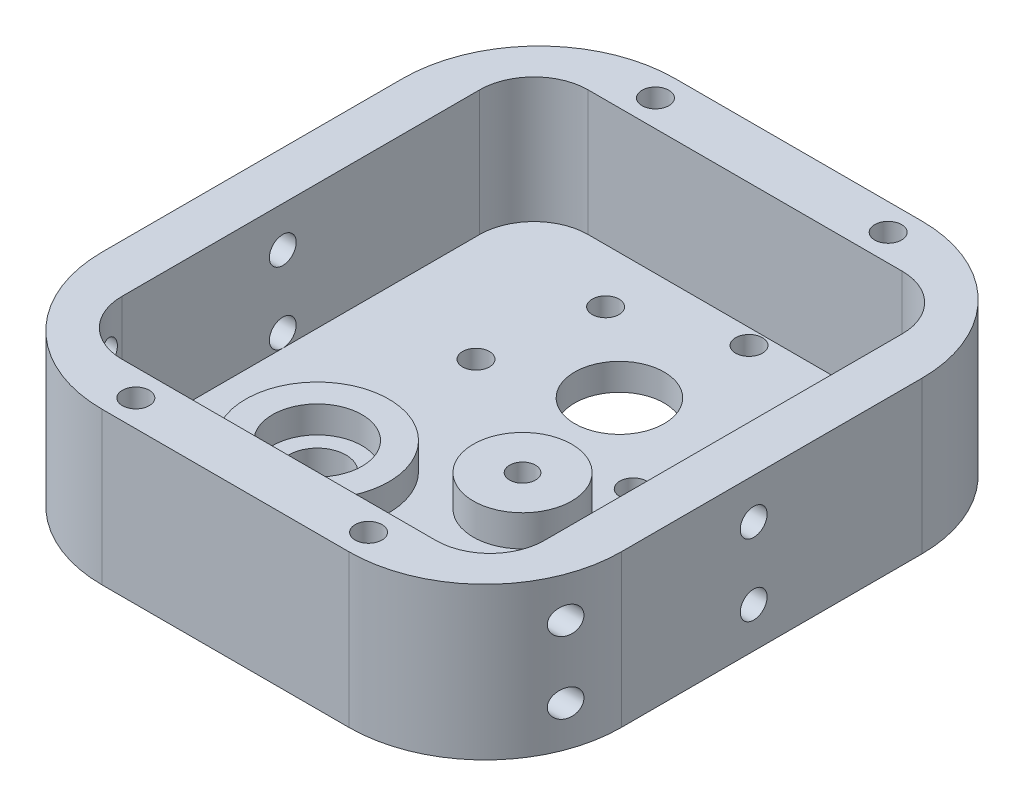
from build123d import *

# Parameters (mm, degrees)
SKETCH1_R           = 3.2
SKETCH1_R_2         = 5
SKETCH1_R_3         = 1.45
BOSS_EXTRUDE1_DEPTH = 3
SKETCH1_4_R         = 5.5
SKETCH1_4_R_2       = 1.45
BOSS_EXTRUDE2_DEPTH = 6.5
SKETCH1_5_R         = 8
SKETCH1_5_R_2       = 5
BOSS_EXTRUDE3_DEPTH = 6
BOSS_EXTRUDE4_DEPTH = 17
SKETCH4_R           = 1.5
CUT_EXTRUDE2_DEPTH  = 14
SKETCH2_R           = 1.5
CUT_EXTRUDE4_DEPTH  = 3
SKETCH5_R           = 1.5
CUT_EXTRUDE5_DEPTH  = 8


with BuildPart() as part:
    # Sketch1 → Boss-Extrude1 (new body)
    with BuildSketch(Plane(origin=(0, 0, 0), x_dir=(1, 0, 0), z_dir=(0, 1, 0))):
        with BuildLine():
            Line((-29, -28.777515286), (-29, 4.777515286))
            ThreePointArc((-29, 4.777515286), (-24.541437454, 15.541437454), (-13.777515286, 20))
            Line((-13.777515286, 20), (13.777515286, 20))
            ThreePointArc((13.777515286, 20), (24.541437454, 15.541437454), (29, 4.777515286))
            Line((29, 4.777515286), (29, -28.777515286))
            ThreePointArc((29, -28.777515286), (24.541437454, -39.541437454), (13.777515286, -44))
            Line((13.777515286, -44), (-13.777515286, -44))
            ThreePointArc((-13.777515286, -44), (-24.541437454, -39.541437454), (-29, -28.777515286))
        make_face()
        with Locations(Location((-9.753243024, -24, 0), (0, 0, 270))):
            Circle(SKETCH1_R, mode=Mode.SUBTRACT)
        with Locations(Location((0, 0, 0), (0, 0, 270))):
            Circle(SKETCH1_R_2, mode=Mode.SUBTRACT)
        with Locations(Location((5.323230148, -16.145068002, 0), (0, 0, 270))):
            Circle(SKETCH1_R_3, mode=Mode.SUBTRACT)
    extrude(amount=BOSS_EXTRUDE1_DEPTH)

    # Sketch1<4> → Boss-Extrude2 (add)
    with BuildSketch(Plane(origin=(0, 0, 0), x_dir=(1, 0, 0), z_dir=(0, 1, 0))):
        with Locations(Location((5.323230148, -16.145068002, 0), (0, 0, 90))):
            Circle(SKETCH1_4_R)
        with Locations(Location((5.323230148, -16.145068002, 0), (0, 0, 270))):
            Circle(SKETCH1_4_R_2, mode=Mode.SUBTRACT)
    extrude(amount=BOSS_EXTRUDE2_DEPTH)

    # Sketch1<5> → Boss-Extrude3 (add)
    with BuildSketch(Plane(origin=(0, 0, 0), x_dir=(1, 0, 0), z_dir=(0, 1, 0))):
        with Locations(Location((-9.753243024, -24, 0), (0, 0, 270))):
            Circle(SKETCH1_5_R)
        with Locations(Location((-9.753243024, -24, 0), (0, 0, 270))):
            Circle(SKETCH1_5_R_2, mode=Mode.SUBTRACT)
    extrude(amount=BOSS_EXTRUDE3_DEPTH)

    # Sketch3 → Boss-Extrude4 (add)
    with BuildSketch(Plane(origin=(0, 0, 0), x_dir=(1, 0, 0), z_dir=(0, 1, 0))):
        with BuildLine():
            Line((-13.777515286, -44), (13.777515286, -44))
            ThreePointArc((13.777515286, -44), (24.541437454, -39.541437454), (29, -28.777515286))
            Line((29, -28.777515286), (29, 4.777515286))
            ThreePointArc((29, 4.777515286), (24.541437454, 15.541437454), (13.777515286, 20))
            Line((13.777515286, 20), (-13.777515286, 20))
            ThreePointArc((-13.777515286, 20), (-24.541437454, 15.541437454), (-29, 4.777515286))
            Line((-29, 4.777515286), (-29, -28.777515286))
            ThreePointArc((-29, -28.777515286), (-24.541437454, -39.541437454), (-13.777515286, -44))
        make_face()
        with BuildLine():
            Line((-17.54612958, -38.049633972), (17.54612958, -38.049633972))
            ThreePointArc((17.54612958, -38.049633972), (21.832152122, -36.274305307), (23.607480787, -31.988282765))
            Line((23.607480787, -31.988282765), (23.607480787, 7.988282765))
            ThreePointArc((23.607480787, 7.988282765), (21.832152122, 12.274305307), (17.54612958, 14.049633972))
            Line((17.54612958, 14.049633972), (-17.54612958, 14.049633972))
            ThreePointArc((-17.54612958, 14.049633972), (-21.832152122, 12.274305307), (-23.607480787, 7.988282765))
            Line((-23.607480787, 7.988282765), (-23.607480787, -31.988282765))
            ThreePointArc((-23.607480787, -31.988282765), (-21.832152122, -36.274305307), (-17.54612958, -38.049633972))
        make_face(mode=Mode.SUBTRACT)
    extrude(amount=BOSS_EXTRUDE4_DEPTH)

    # Sketch4 → Cut-Extrude2 (cut)
    with BuildSketch(Plane(origin=(0, 17, 0), x_dir=(1, 0, 0), z_dir=(0, 1, 0))):
        with Locations(Location((13, 17.024816986, 0), (0, 0, 270))):
            Circle(SKETCH4_R)
        with Locations(Location((-13, 17.024816986, 0), (0, 0, 270))):
            Circle(SKETCH4_R)
        with Locations(Location((-13, -41.024816986, 0), (0, 0, 270))):
            Circle(SKETCH4_R)
        with Locations(Location((13, -41.024816986, 0), (0, 0, 270))):
            Circle(SKETCH4_R)
    extrude(amount=-CUT_EXTRUDE2_DEPTH, mode=Mode.SUBTRACT)

    # Sketch2 → Cut-Extrude4 (cut)
    with BuildSketch(Plane(origin=(0, 0, 0), x_dir=(1, 0, 0), z_dir=(0, 1, 0))):
        with Locations(Location((2.170602221, 12.310096913, 0), (0, 0, 270))):
            Circle(SKETCH2_R)
        with Locations(Location((-9.575555539, 8.034845121, 0), (0, 0, 270))):
            Circle(SKETCH2_R)
        with Locations(Location((-11.74615776, -4.275251792, 0), (0, 0, 270))):
            Circle(SKETCH2_R)
        with Locations(Location((-2.170602221, -12.310096913, 0), (0, 0, 270))):
            Circle(SKETCH2_R)
        with Locations(Location((11.74615776, 4.275251792, 0), (0, 0, 270))):
            Circle(SKETCH2_R)
        with Locations(Location((9.575555539, -8.034845121, 0), (0, 0, 270))):
            Circle(SKETCH2_R)
    extrude(amount=CUT_EXTRUDE4_DEPTH, mode=Mode.SUBTRACT)

    # Sketch5 → Cut-Extrude5 (cut)
    with BuildSketch(Plane(origin=(29, 0, 0), x_dir=(0, 0, -1), z_dir=(1, 0, 0))):
        with Locations((-34, 12.5)):
            Circle(SKETCH5_R)
        with Locations((-34, 4.5)):
            Circle(SKETCH5_R)
        with Locations(Location((-14, 4.5, 0), (0, 0, 270))):
            Circle(SKETCH5_R)
        with Locations(Location((-14, 12.5, 0), (0, 0, 180))):
            Circle(SKETCH5_R)
    cut_extrude5 = extrude(amount=-CUT_EXTRUDE5_DEPTH, mode=Mode.SUBTRACT)

    # Mirror1: Cut-Extrude5 across plane
    add(cut_extrude5.mirror(Plane(origin=(0, 0, 0), x_dir=(0, 0, 1), z_dir=(1, 0, 0))), mode=Mode.SUBTRACT)


solid = part.part
